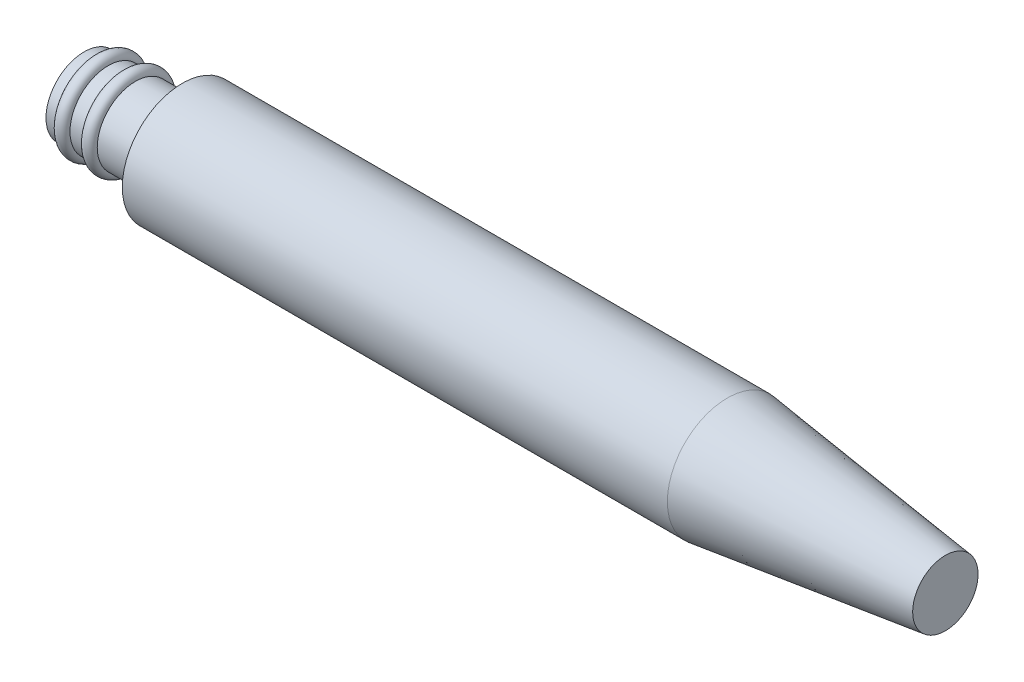
from build123d import *


with BuildPart() as part:
    # Sketch1 → Revolve1 (revolve)
    with BuildSketch(Plane.XY, mode=Mode.PRIVATE) as revolve1_sk:
        with BuildLine():
            Line((172.16927252, 153.812567331), (192.23527252, 153.812567331))
            Line((192.23527252, 153.812567331), (192.23527252, 154.574567331))
            Line((192.23527252, 154.574567331), (187.15527252, 155.209567331))
            Line((187.15527252, 155.209567331), (174.45527252, 155.209567331))
            Line((174.45527252, 155.209567331), (174.45527252, 154.701567331))
            Line((174.45527252, 154.701567331), (173.36307252, 154.701567331))
            ThreePointArc((173.36307252, 154.701567331), (173.21067252, 154.853967331), (173.05827252, 154.701567331))
            Line((173.05827252, 154.701567331), (172.72807252, 154.701567331))
            ThreePointArc((172.72807252, 154.701567331), (172.57567252, 154.853967331), (172.42327252, 154.701567331))
            Line((172.42327252, 154.701567331), (172.16927252, 154.701567331))
            Line((172.16927252, 154.701567331), (172.16927252, 153.812567331))
        make_face()
    revolve(revolve1_sk.sketch.rotate(Axis((172.16927252, 153.812567331, 0), (1, 0, 0)), 90), axis=Axis((172.16927252, 153.812567331, 0), (1, 0, 0)))


solid = part.part
